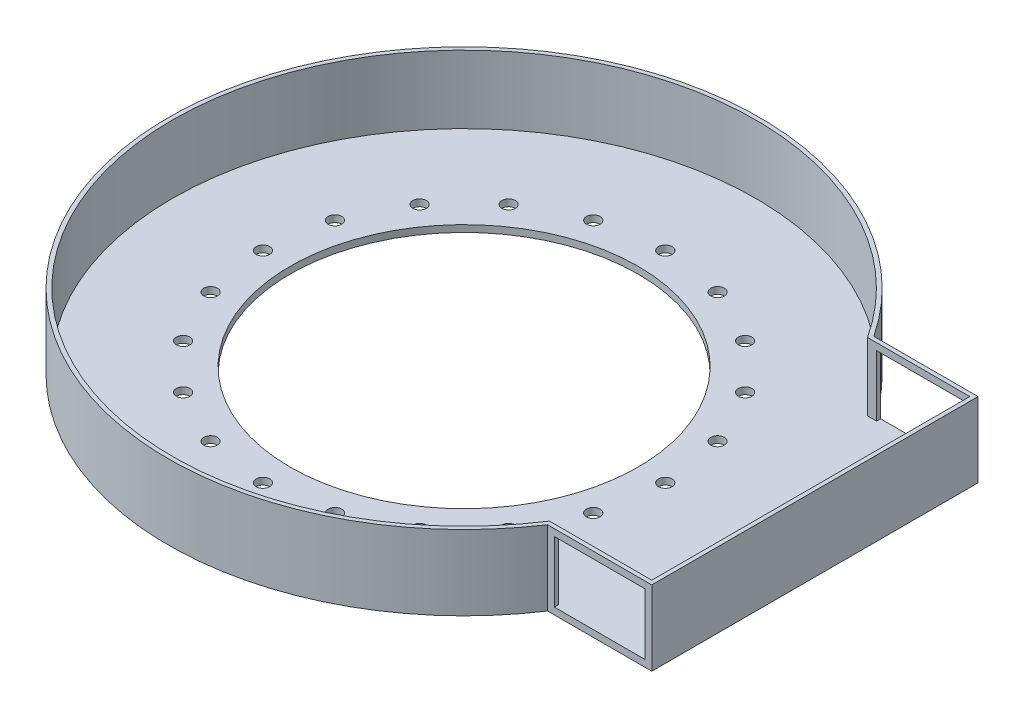
from build123d import *

# Parameters (mm, degrees)
ESQUISSE1_W                  = 80
ESQUISSE1_H                  = 10
ESQUISSE3_R                  = 10
ENL_V_MAT_EXTRU_1_DEPTH      = 476.280969533
R_P_TITION_CIRCULAIRE1_COUNT = 20
BOSS_EXTRU_1_START           = -10
BOSS_EXTRU_1_DEPTH           = 10
BOSS_EXTRU_2_START           = -10
BOSS_EXTRU_2_DEPTH           = 10
BOSS_EXTRU_3_START           = 100
BOSS_EXTRU_3_DEPTH           = 100
ESQUISSE8_W                  = 133.349416634
ESQUISSE8_H                  = 90
ENL_V_MAT_EXTRU_2_DEPTH      = 857.817874815


with BuildPart() as part:
    # Esquisse1 → Révolution1 (revolve)
    with BuildSketch(Plane.XY, mode=Mode.PRIVATE) as r_volution1_sk:
        with Locations((296, 5)):
            Rectangle(ESQUISSE1_W, ESQUISSE1_H)
    revolve(r_volution1_sk.sketch.rotate(Axis((0, 0, 0), (0, 1, 0)), 90), axis=Axis((0, 0, 0), (0, 1, 0)))

    # Esquisse3 → Enlèv. mat.-Extru.1 (cut, through all)
    with BuildSketch(Plane(origin=(0, 10, 0), x_dir=(1, 0, 0), z_dir=(0, 1, 0))):
        with Locations(Location((296, 0, 0), (0, 0, 270))):
            Circle(ESQUISSE3_R)
    enl_v_mat_extru_1 = extrude(amount=-ENL_V_MAT_EXTRU_1_DEPTH, mode=Mode.SUBTRACT)

    # Répétition circulaire1: Enlèv. mat.-Extru.1 ×20 about axis
    r_p_tition_circulaire1_axis = Axis((0, 0, 0), (0, 1, 0))
    for i in range(1, R_P_TITION_CIRCULAIRE1_COUNT):
        add(enl_v_mat_extru_1.rotate(r_p_tition_circulaire1_axis, i * 360 / R_P_TITION_CIRCULAIRE1_COUNT), mode=Mode.SUBTRACT)

    # Esquisse4 → Boss.-Extru.1 (add)
    with BuildSketch(Plane.XZ.offset(BOSS_EXTRU_1_START)):
        with BuildLine():
            Line((516.151015307, -240), (516.151015307, 240))
            Line((516.151015307, 240), (235.151015307, 240))
            ThreePointArc((235.151015307, 240), (336, 0), (235.151015307, -240))
            Line((235.151015307, -240), (516.151015307, -240))
        make_face()
    extrude(amount=BOSS_EXTRU_1_DEPTH)

    # Esquisse5 → Boss.-Extru.2 (add)
    with BuildSketch(Plane.XZ.offset(BOSS_EXTRU_2_START)):
        with BuildLine():
            Line((235.151015307, -240), (362.801598673, -240))
            ThreePointArc((362.801598673, -240), (-435, 0), (362.801598673, 240))
            Line((362.801598673, 240), (235.151015307, 240))
            ThreePointArc((235.151015307, 240), (-336, 0), (235.151015307, -240))
        make_face()
    extrude(amount=BOSS_EXTRU_2_DEPTH)

    # Esquisse6 → Boss.-Extru.3 (add)
    with BuildSketch(Plane(origin=(0, 10, 0), x_dir=(1, 0, 0), z_dir=(0, 1, 0)).offset(BOSS_EXTRU_3_START)):
        with BuildLine():
            Line((516.151015307, 240), (362.801598673, 240))
            ThreePointArc((362.801598673, 240), (-435, 0), (362.801598673, -240))
            Line((362.801598673, -240), (516.151015307, -240))
            Line((516.151015307, -240), (516.151015307, 240))
        make_face()
        with BuildLine():
            ThreePointArc((359.562233834, 234), (-429, 0), (359.562233834, -234))
            Line((359.562233834, -234), (510.151015307, -234))
            Line((510.151015307, -234), (510.151015307, 234))
            Line((510.151015307, 234), (359.562233834, 234))
        make_face(mode=Mode.SUBTRACT)
    extrude(amount=-BOSS_EXTRU_3_DEPTH)

    # Esquisse8 → Enlèv. mat.-Extru.2 (cut, through all)
    with BuildSketch(Plane.XY.offset(240)):
        with Locations((439.47630699, 55)):
            Rectangle(ESQUISSE8_W, ESQUISSE8_H)
    extrude(amount=-ENL_V_MAT_EXTRU_2_DEPTH, mode=Mode.SUBTRACT)


solid = part.part
